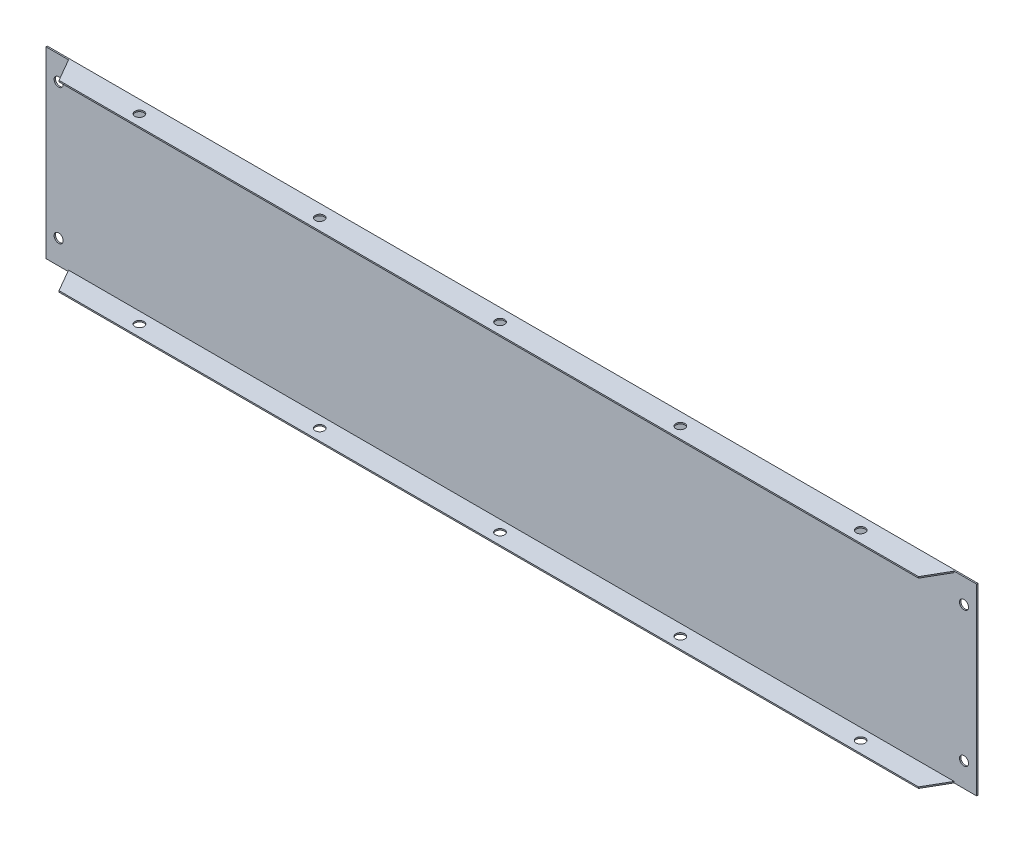
from build123d import *

# Parameters (mm, degrees)
SKETCH_1_W      = 412.9
SKETCH_1_H      = 81.4
SKETCH_1_R      = 2
EXTRUDE_1_DEPTH = 0.6
SKETCH_2_R      = 2
EXTRUDE_2_DEPTH = 0.6
EXTRUDE_START   = -0.6
SKETCH_3_R      = 2
EXTRUDE_3_DEPTH = 0.6


with BuildPart() as part:
    # Эскиз1 → Бобышка-Вытянуть1 (new body)
    with BuildSketch(Plane.XY):
        with Locations((241.1, 40.7)):
            Rectangle(SKETCH_1_W, SKETCH_1_H)
        with Locations((40.25, 10.7)):
            Circle(SKETCH_1_R, mode=Mode.SUBTRACT)
        with Locations((441.95, 10.7)):
            Circle(SKETCH_1_R, mode=Mode.SUBTRACT)
        with Locations((40.25, 70.7)):
            Circle(SKETCH_1_R, mode=Mode.SUBTRACT)
        with Locations((441.95, 70.7)):
            Circle(SKETCH_1_R, mode=Mode.SUBTRACT)
    extrude(amount=EXTRUDE_1_DEPTH)

    # Эскиз2 → Бобышка-Вытянуть2 (add)
    with BuildSketch(Plane(origin=(0, 81.4, 0), x_dir=(1, 0, 0), z_dir=(0, 1, 0))):
        Polygon((44.65, -0.6), (50.423502692, -10.6), (431.776497308, -10.6), (437.55, -0.6), align=None)
        with Locations(Location((401.1, -5.6, 0), (0, 0, 180))):
            Circle(SKETCH_2_R, mode=Mode.SUBTRACT)
        with Locations(Location((321.1, -5.6, 0), (0, 0, 180))):
            Circle(SKETCH_2_R, mode=Mode.SUBTRACT)
        with Locations(Location((241.1, -5.6, 0), (0, 0, 180))):
            Circle(SKETCH_2_R, mode=Mode.SUBTRACT)
        with Locations(Location((161.1, -5.6, 0), (0, 0, 180))):
            Circle(SKETCH_2_R, mode=Mode.SUBTRACT)
        with Locations(Location((81.1, -5.6, 0), (0, 0, 180))):
            Circle(SKETCH_2_R, mode=Mode.SUBTRACT)
    extrude(amount=-EXTRUDE_2_DEPTH)

    # Эскиз3 → Бобышка-Вытянуть3 (add)
    with BuildSketch(Plane.XZ.offset(EXTRUDE_START)):
        Polygon((44.65, 0.6), (437.55, 0.6), (431.776497308, 10.6), (50.423502692, 10.6), align=None)
        with Locations(Location((401.1, 5.6, 0), (0, 0, 180))):
            Circle(SKETCH_3_R, mode=Mode.SUBTRACT)
        with Locations(Location((321.1, 5.6, 0), (0, 0, 180))):
            Circle(SKETCH_3_R, mode=Mode.SUBTRACT)
        with Locations(Location((241.1, 5.6, 0), (0, 0, 180))):
            Circle(SKETCH_3_R, mode=Mode.SUBTRACT)
        with Locations(Location((161.1, 5.6, 0), (0, 0, 180))):
            Circle(SKETCH_3_R, mode=Mode.SUBTRACT)
        with Locations(Location((81.1, 5.6, 0), (0, 0, 180))):
            Circle(SKETCH_3_R, mode=Mode.SUBTRACT)
    extrude(amount=EXTRUDE_3_DEPTH)


solid = part.part
